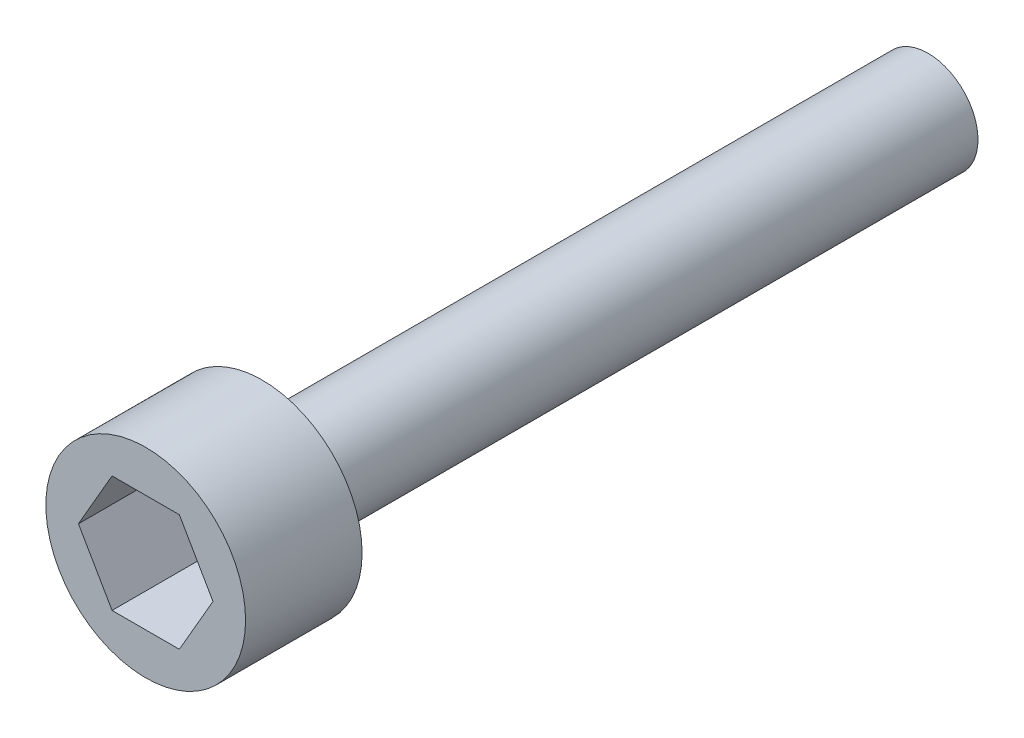
from build123d import *

# Parameters (mm, degrees)
SKETCH1_R                   = 3
HEAD_BOSS_EXTRUDE1_DEPTH    = 3.5
HEAD_HEX_CUT_EXTRUDE1_DEPTH = 2.8
SKETCH2_R                   = 1.5
SCREW_BOSS_EXTRUDE2_DEPTH   = 20


with BuildPart() as part:
    # Sketch1 → Head Boss-Extrude1 (new body)
    with BuildSketch(Plane.XY):
        Circle(SKETCH1_R)
    extrude(amount=HEAD_BOSS_EXTRUDE1_DEPTH)

    # Sketch3 → Head Hex Cut-Extrude1 (cut)
    with BuildSketch(Plane.XY.offset(3.5)):
        Polygon((-1.010362971, 1.75), (1.010362971, 1.75), (2.020725942, 0), (1.010362971, -1.75), (-1.010362971, -1.75), (-2.020725942, 0), align=None)
    extrude(amount=-HEAD_HEX_CUT_EXTRUDE1_DEPTH, mode=Mode.SUBTRACT)

    # Sketch2 → Screw Boss-Extrude2 (add)
    with BuildSketch(Plane.XY):
        Circle(SKETCH2_R)
    extrude(amount=-SCREW_BOSS_EXTRUDE2_DEPTH)


solid = part.part
